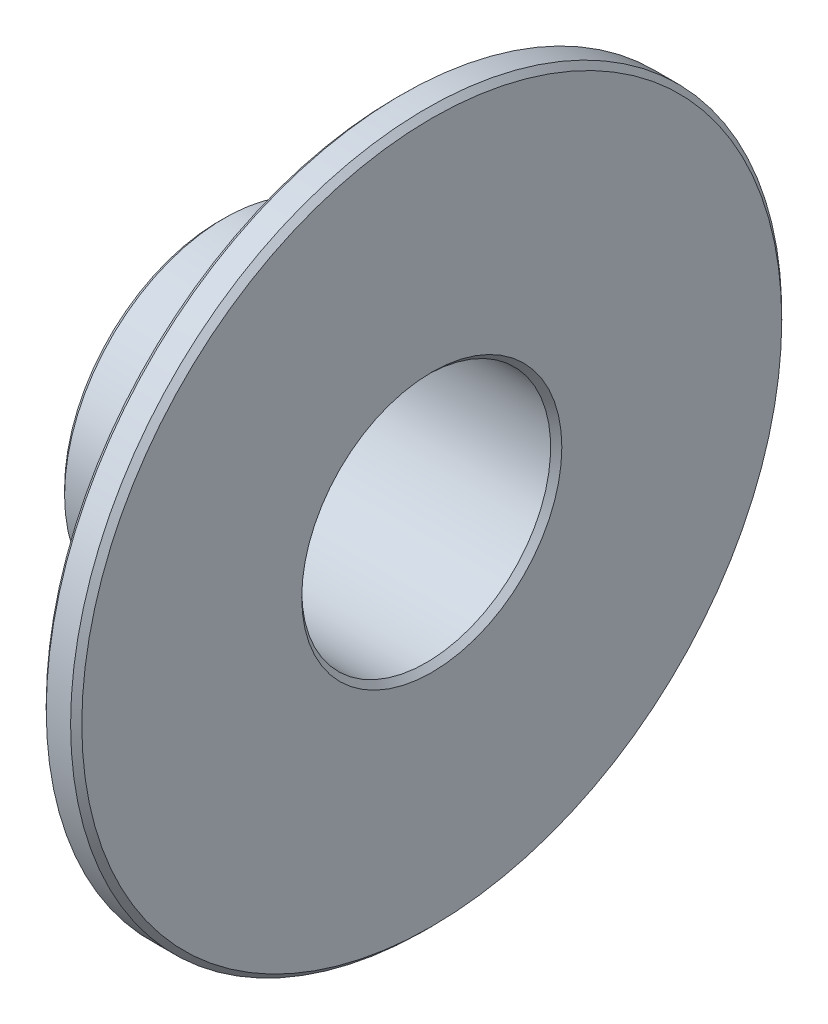
from build123d import *


with BuildPart() as part:
    # Sketch1 → Revolve1 (revolve)
    with BuildSketch(Plane.XY, mode=Mode.PRIVATE) as revolve1_sk:
        Polygon((-15.825, 13.7875), (-15.825, 11.6125), (-15.325, 11.1125), (2.675, 11.1125), (3.175, 11.6125), (3.175, 31.25), (2.675, 31.75), (0.5, 31.75), (0, 31.25), (0, 14.2875), (-15.325, 14.2875), align=None)
    revolve(revolve1_sk.sketch.rotate(Axis((0, 0, 0), (1, 0, 0)), 90), axis=Axis((0, 0, 0), (1, 0, 0)))


solid = part.part
